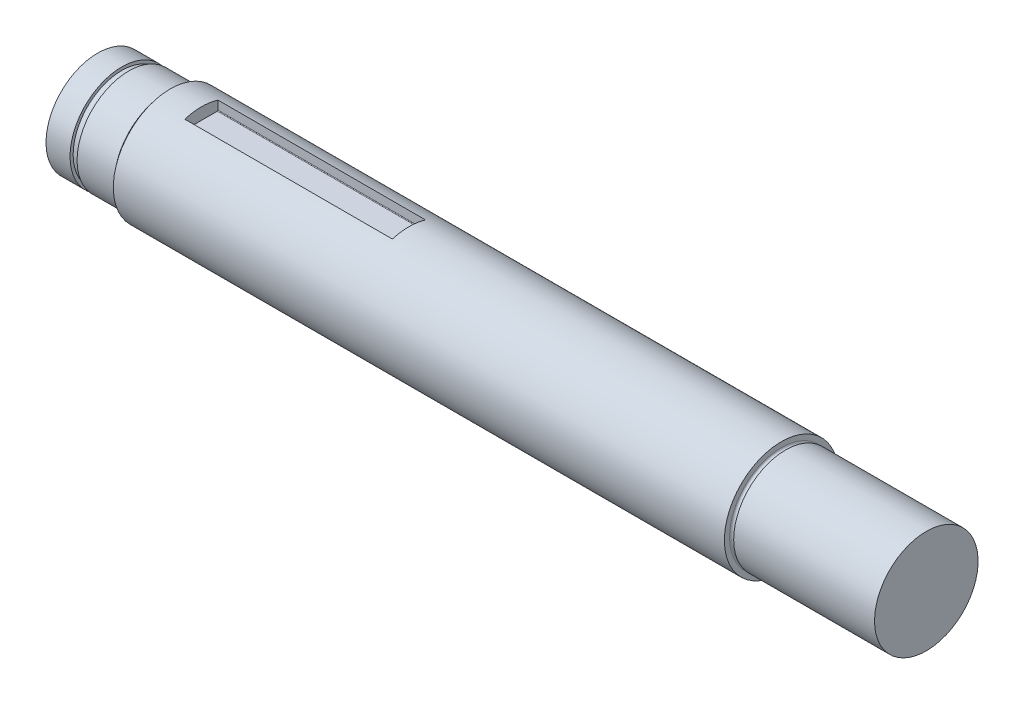
from build123d import *

# Parameters (mm, degrees)
SKETCH1_R           = 27.5
BOSS_EXTRUDE1_DEPTH = 100
SKETCH1_4_R         = 25
BOSS_EXTRUDE2_DEPTH = 175
BOSS_EXTRUDE4_START = 95
SKETCH6_R           = 27.5
SKETCH6_R_2         = 25
BOSS_EXTRUDE4_DEPTH = 95
BOSS_EXTRUDE5_START = 90
SKETCH8_R           = 25
BOSS_EXTRUDE5_DEPTH = 90
CUT_EXTRUDE1_START  = -115.215
CUT_EXTRUDE1_DEPTH  = 100.215
CUT_EXTRUDE3_START  = -40
SKETCH10_R          = 25
CUT_EXTRUDE3_DEPTH  = 40
CUT_EXTRUDE4_START  = 20
SKETCH11_R          = 25
SKETCH11_R_2        = 23.5
CUT_EXTRUDE4_DEPTH  = 3.4


with BuildPart() as part:
    # Sketch1 → Boss-Extrude1 (new, symmetric)
    with BuildSketch(Plane(origin=(0, 0, 0), x_dir=(0, 0, -1), z_dir=(1, 0, 0))):
        Circle(SKETCH1_R)
    extrude(amount=BOSS_EXTRUDE1_DEPTH, both=True)

    # Sketch1<4> → Boss-Extrude2 (add, symmetric)
    with BuildSketch(Plane(origin=(0, 0, 0), x_dir=(0, 0, -1), z_dir=(1, 0, 0))):
        Circle(SKETCH1_4_R)
    extrude(amount=BOSS_EXTRUDE2_DEPTH, both=True)

    # Sketch6 → Boss-Extrude4 (add)
    with BuildSketch(Plane(origin=(100, 0, 0), x_dir=(0, 0, -1), z_dir=(1, 0, 0)).offset(BOSS_EXTRUDE4_START)):
        Circle(SKETCH6_R)
        Circle(SKETCH6_R_2, mode=Mode.SUBTRACT)
    extrude(amount=-BOSS_EXTRUDE4_DEPTH)

    # Sketch8 → Boss-Extrude5 (add)
    with BuildSketch(Plane(origin=(175, 0, 0), x_dir=(0, 0, -1), z_dir=(1, 0, 0)).offset(BOSS_EXTRUDE5_START)):
        Circle(SKETCH8_R)
    extrude(amount=-BOSS_EXTRUDE5_DEPTH)

    # Sketch3 → Cut-Revolve1 (revolve, cut)
    with BuildSketch(Plane.XY):
        with BuildLine():
            Line((195, 25), (197, 25))
            ThreePointArc((197, 25), (196, 24), (195, 25))
        make_face()
        with BuildLine():
            Line((-100, 25), (-102, 25))
            ThreePointArc((-102, 25), (-101, 24), (-100, 25))
        make_face()
    revolve(axis=Axis((-100, 0, 0), (1, 0, 0)), mode=Mode.SUBTRACT)

    # Sketch4 → Cut-Extrude1 (cut)
    with BuildSketch(Plane.ZY.offset(100).offset(CUT_EXTRUDE1_START)):
        with BuildLine():
            Line((-8, 26.310644234), (-8, 22.1))
            ThreePointArc((-8, 22.1), (-7.912132034, 21.887867966), (-7.7, 21.8))
            Line((-7.7, 21.8), (7.7, 21.8))
            ThreePointArc((7.7, 21.8), (7.912132034, 21.887867966), (8, 22.1))
            Line((8, 22.1), (8, 26.310644234))
            ThreePointArc((8, 26.310644234), (0, 27.5), (-8, 26.310644234))
        make_face()
    extrude(amount=CUT_EXTRUDE1_DEPTH, mode=Mode.SUBTRACT)

    # Sketch10 → Cut-Extrude3 (cut)
    with BuildSketch(Plane.ZY.offset(175).offset(CUT_EXTRUDE3_START)):
        Circle(SKETCH10_R)
    extrude(amount=CUT_EXTRUDE3_DEPTH, mode=Mode.SUBTRACT)

    # Sketch11 → Cut-Extrude4 (cut)
    with BuildSketch(Plane.ZY.offset(100).offset(CUT_EXTRUDE4_START)):
        Circle(SKETCH11_R)
        Circle(SKETCH11_R_2, mode=Mode.SUBTRACT)
    extrude(amount=CUT_EXTRUDE4_DEPTH, mode=Mode.SUBTRACT)


solid = part.part
